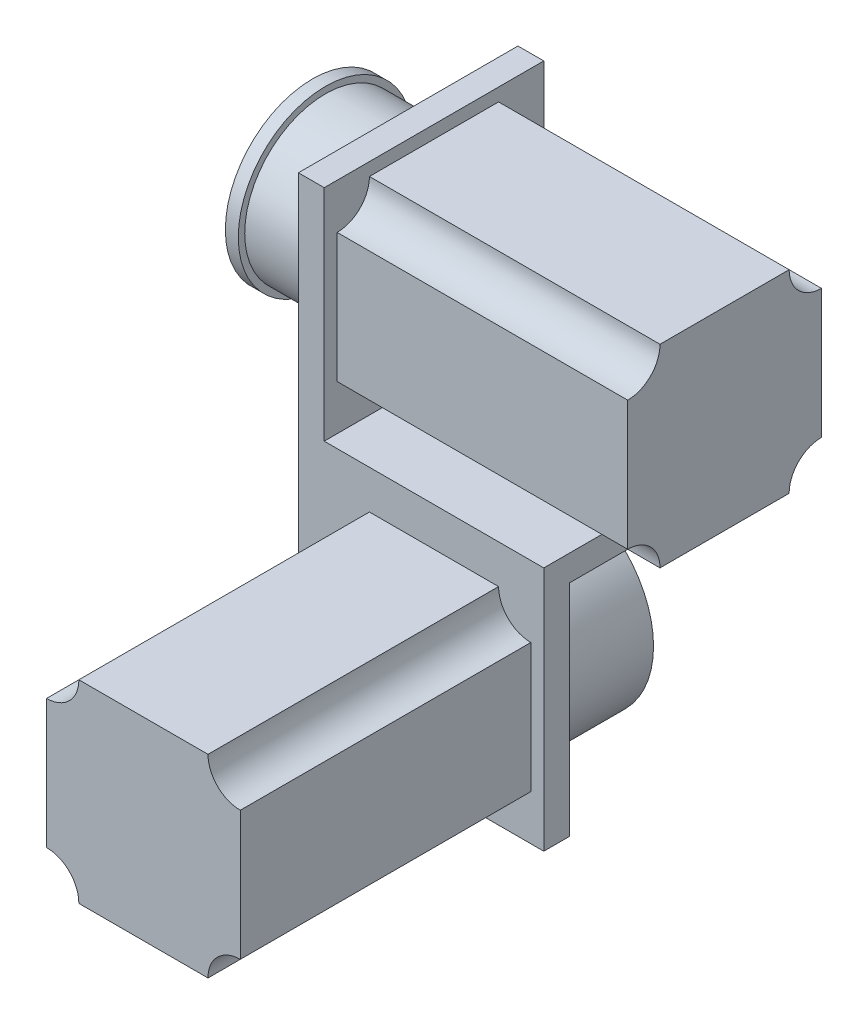
from build123d import *

# Parameters (mm, degrees)
BOSS_EXTRUDE1_DEPTH = 170
SKETCH3_R           = 62.5
BOSS_EXTRUDE2_DEPTH = 75
SKETCH4_W           = 150
SKETCH4_H           = 150
BOSS_EXTRUDE3_DEPTH = 225
CUT_EXTRUDE6_DEPTH  = 225
SKETCH7_W           = 190
SKETCH7_H           = 20
BOSS_EXTRUDE5_DEPTH = 170
SKETCH10_W          = 150
SKETCH10_H          = 150
BOSS_EXTRUDE7_DEPTH = 225
CUT_EXTRUDE7_DEPTH  = 225
SKETCH12_R          = 75
SKETCH12_R_2        = 62.5
BOSS_EXTRUDE8_DEPTH = 75
BOSS_EXTRUDE9_START = -10
SKETCH13_R          = 67.5
SKETCH13_R_2        = 62.5
BOSS_EXTRUDE9_DEPTH = 10
SKETCH14_W          = 10
SKETCH14_H          = 14.038601632


with BuildPart() as part:
    # Sketch2 → Boss-Extrude1 (new body)
    with BuildSketch(Plane.XY):
        Polygon((-40.398264296, 30.238450413), (-20.398264296, 30.238450413), (-20.398264296, -139.761549587), (149.601735704, -139.761549587), (149.601735704, -159.761549587), (-40.398264296, -159.761549587), align=None)
    extrude(amount=-BOSS_EXTRUDE1_DEPTH)

    # Sketch3 → Boss-Extrude2 (add)
    with BuildSketch(Plane.ZY.offset(40.398264296)):
        with Locations((-85.93846623, -54.761549587)):
            Circle(SKETCH3_R)
    extrude(amount=BOSS_EXTRUDE2_DEPTH)

    # Sketch4 → Boss-Extrude3 (add)
    with BuildSketch(Plane(origin=(-20.398264296, 0, 0), x_dir=(0, 0, -1), z_dir=(1, 0, 0))):
        with Locations((85, -54.761549587)):
            Rectangle(SKETCH4_W, SKETCH4_H)
    extrude(amount=BOSS_EXTRUDE3_DEPTH)

    # Sketch5 → Cut-Extrude6 (cut)
    with BuildSketch(Plane(origin=(204.601735704, 0, 0), x_dir=(0, 0, -1), z_dir=(1, 0, 0))):
        with BuildLine():
            Line((35, 20.238450413), (10, 20.238450413))
            Line((10, 20.238450413), (10, -4.761549587))
            ThreePointArc((10, -4.761549587), (27.67766953, 2.560780883), (35, 20.238450413))
        make_face()
        with BuildLine():
            ThreePointArc((35, -129.761549587), (27.67766953, -112.083880057), (10, -104.761549587))
            Line((10, -104.761549587), (10, -129.761549587))
            Line((10, -129.761549587), (35, -129.761549587))
        make_face()
        with BuildLine():
            ThreePointArc((160, -104.761549587), (142.32233047, -112.083880057), (135, -129.761549587))
            Line((135, -129.761549587), (160, -129.761549587))
            Line((160, -129.761549587), (160, -104.761549587))
        make_face()
        with BuildLine():
            Line((160, 20.238450413), (135, 20.238450413))
            ThreePointArc((135, 20.238450413), (142.32233047, 2.560780883), (160, -4.761549587))
            Line((160, -4.761549587), (160, 20.238450413))
        make_face()
    extrude(amount=-CUT_EXTRUDE6_DEPTH, mode=Mode.SUBTRACT)

    # Sketch7 → Boss-Extrude5 (add)
    with BuildSketch(Plane.XZ.offset(159.761549587)):
        with Locations((54.601735704, -10)):
            Rectangle(SKETCH7_W, SKETCH7_H)
    extrude(amount=BOSS_EXTRUDE5_DEPTH)

    # Sketch10 → Boss-Extrude7 (add)
    with BuildSketch(Plane.XY):
        with Locations((64.601735704, -244.761549587)):
            Rectangle(SKETCH10_W, SKETCH10_H)
    extrude(amount=BOSS_EXTRUDE7_DEPTH)

    # Sketch11 → Cut-Extrude7 (cut)
    with BuildSketch(Plane.XY.offset(225)):
        with BuildLine():
            Line((14.601735704, -169.761549587), (-10.398264296, -169.761549587))
            Line((-10.398264296, -169.761549587), (-10.398264296, -194.761549587))
            ThreePointArc((-10.398264296, -194.761549587), (7.279405234, -187.439219117), (14.601735704, -169.761549587))
        make_face()
        with BuildLine():
            Line((139.601735704, -169.761549587), (114.601735704, -169.761549587))
            ThreePointArc((114.601735704, -169.761549587), (121.924066175, -187.439219117), (139.601735704, -194.761549587))
            Line((139.601735704, -194.761549587), (139.601735704, -169.761549587))
        make_face()
        with BuildLine():
            ThreePointArc((139.601735704, -294.761549587), (121.924066175, -302.083880057), (114.601735704, -319.761549587))
            Line((114.601735704, -319.761549587), (139.601735704, -319.761549587))
            Line((139.601735704, -319.761549587), (139.601735704, -294.761549587))
        make_face()
        with BuildLine():
            ThreePointArc((14.601735704, -319.761549587), (7.279405234, -302.083880057), (-10.398264296, -294.761549587))
            Line((-10.398264296, -294.761549587), (-10.398264296, -319.761549587))
            Line((-10.398264296, -319.761549587), (14.601735704, -319.761549587))
        make_face()
    extrude(amount=-CUT_EXTRUDE7_DEPTH, mode=Mode.SUBTRACT)

    # Sketch12 → Boss-Extrude8 (add)
    with BuildSketch(Plane(origin=(0, 0, -20), x_dir=(-1, 0, 0), z_dir=(0, 0, -1))):
        with Locations(Location((-64.601735704, -244.761549587, 0), (0, 0, 180))):
            Circle(SKETCH12_R)
        with Locations((-64.601735704, -244.761549587)):
            Circle(SKETCH12_R_2, mode=Mode.SUBTRACT)
    extrude(amount=BOSS_EXTRUDE8_DEPTH)

    # Sketch13 → Boss-Extrude9 (add)
    with BuildSketch(Plane.ZY.offset(115.398264296).offset(BOSS_EXTRUDE9_START)):
        with Locations((-85.93846623, -54.761549587)):
            Circle(SKETCH13_R)
        with Locations((-85.93846623, -54.761549587)):
            Circle(SKETCH13_R_2, mode=Mode.SUBTRACT)
    extrude(amount=BOSS_EXTRUDE9_DEPTH)

    # Sketch14 → Cut-Revolve1 (revolve, cut)
    with BuildSketch(Plane(origin=(64.601735704, 0, 0), x_dir=(0, 0, -1), z_dir=(1, 0, 0)), mode=Mode.PRIVATE) as cut_revolve1_sk:
        with Locations((25, -184.280850403)):
            Rectangle(SKETCH14_W, SKETCH14_H)
    revolve(cut_revolve1_sk.sketch.rotate(Axis((64.601735704, -244.761549587, -95), (0, 0, 1)), 90), axis=Axis((64.601735704, -244.761549587, -95), (0, 0, 1)), mode=Mode.SUBTRACT)


solid = part.part
